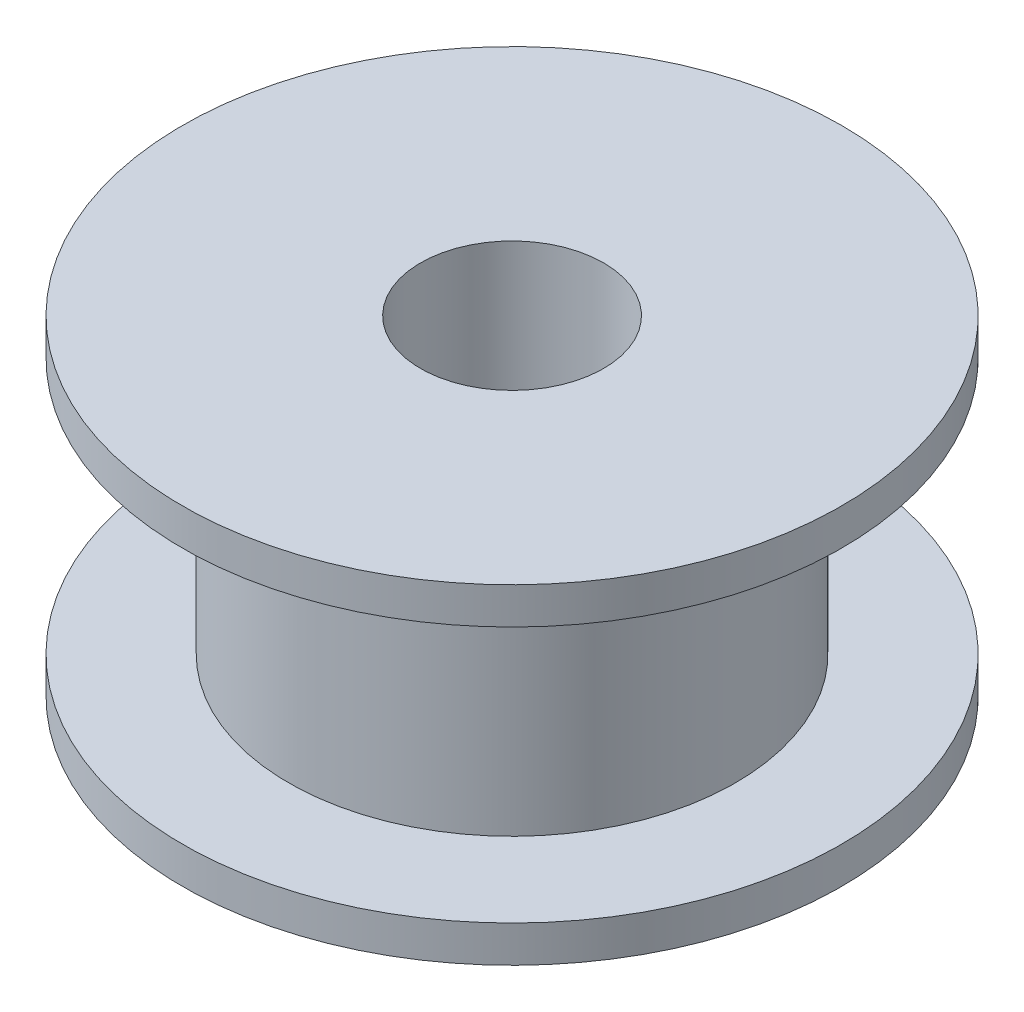
from build123d import *


with BuildPart() as part:
    # Sketch1 → Revolve1 (revolve)
    with BuildSketch(Plane.XY, mode=Mode.PRIVATE) as revolve1_sk:
        Polygon((9, 0), (9, 1), (6.1, 1), (6.1, 8), (9, 8), (9, 9), (2.5, 9), (2.5, 0), align=None)
    revolve(revolve1_sk.sketch.rotate(Axis((0, -0.45, 0), (0, 1, 0)), 90), axis=Axis((0, -0.45, 0), (0, 1, 0)))


solid = part.part
